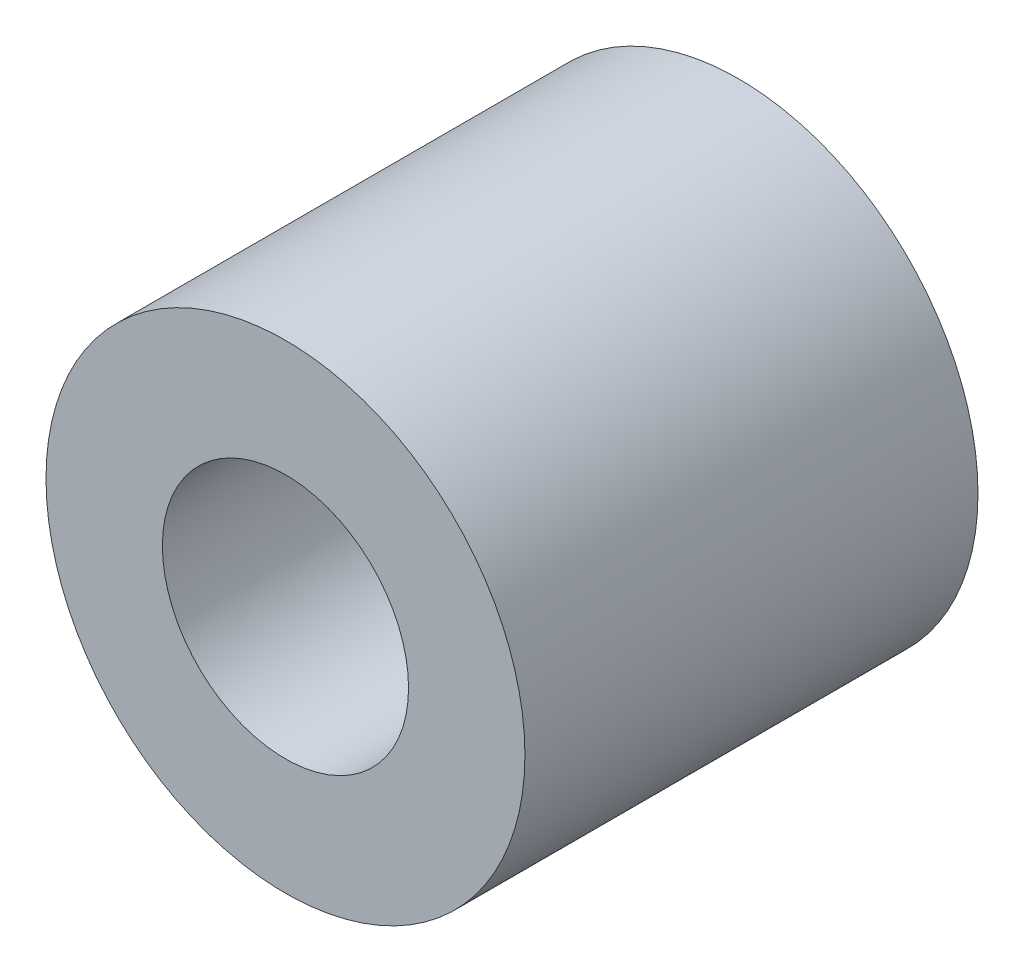
from build123d import *

# Parameters (mm, degrees)
SKETCH1_R           = 6.35
SKETCH1_R_2         = 3.2639
BOSS_EXTRUDE1_DEPTH = 12.0142


with BuildPart() as part:
    # Sketch1 → Boss-Extrude1 (new body)
    with BuildSketch(Plane.XY):
        Circle(SKETCH1_R)
        Circle(SKETCH1_R_2, mode=Mode.SUBTRACT)
    extrude(amount=BOSS_EXTRUDE1_DEPTH)


solid = part.part
